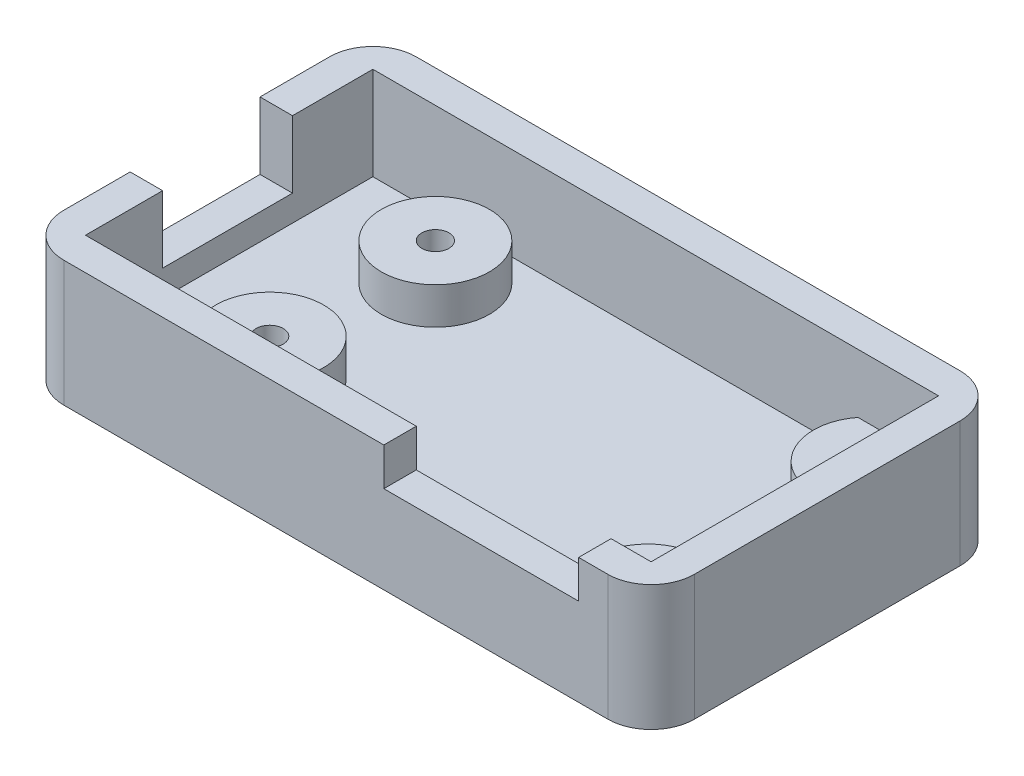
from build123d import *

# Parameters (mm, degrees)
BOSS_EXTRUDE1_DEPTH = 3
BOSS_EXTRUDE2_START = 3
SKETCH1_3_W         = 52.27
SKETCH1_3_H         = 26.56
BOSS_EXTRUDE2_DEPTH = 8.6
BOSS_EXTRUDE3_START = 3
SKETCH1_4_R         = 1.25
SKETCH1_4_R_2       = 5
BOSS_EXTRUDE3_DEPTH = 3.4
CUT_EXTRUDE1_REACH  = 65.526
SKETCH2_W           = 18
SKETCH2_H           = 3.5
CUT_EXTRUDE2_REACH  = 65.627
SKETCH4_W           = 12
SKETCH4_H           = 6.2
SKETCH1_5_R         = 1.25
CUT_EXTRUDE3_DEPTH  = 64.410066236


with BuildPart() as part:
    # Sketch1 → Boss-Extrude1 (new body)
    with BuildSketch(Plane(origin=(0, 0, 0), x_dir=(1, 0, 0), z_dir=(0, 1, 0))):
        with BuildLine():
            Line((-0.75, 3.25), (-51.02, 3.25))
            ThreePointArc((-51.02, 3.25), (-53.848427125, 2.078427125), (-55.02, -0.75))
            Line((-55.02, -0.75), (-55.02, -25.31))
            ThreePointArc((-55.02, -25.31), (-53.848427125, -28.138427125), (-51.02, -29.31))
            Line((-51.02, -29.31), (-0.75, -29.31))
            ThreePointArc((-0.75, -29.31), (2.078427125, -28.138427125), (3.25, -25.31))
            Line((3.25, -25.31), (3.25, -0.75))
            ThreePointArc((3.25, -0.75), (2.078427125, 2.078427125), (-0.75, 3.25))
        make_face()
    extrude(amount=BOSS_EXTRUDE1_DEPTH)

    # Sketch1<3> → Boss-Extrude2 (add)
    with BuildSketch(Plane(origin=(0, 0, 0), x_dir=(1, 0, 0), z_dir=(0, 1, 0)).offset(BOSS_EXTRUDE2_START)):
        with BuildLine():
            ThreePointArc((3.25, -0.75), (2.078427125, 2.078427125), (-0.75, 3.25))
            Line((-0.75, 3.25), (-51.02, 3.25))
            ThreePointArc((-51.02, 3.25), (-53.848427125, 2.078427125), (-55.02, -0.75))
            Line((-55.02, -0.75), (-55.02, -25.31))
            ThreePointArc((-55.02, -25.31), (-53.848427125, -28.138427125), (-51.02, -29.31))
            Line((-51.02, -29.31), (-0.75, -29.31))
            ThreePointArc((-0.75, -29.31), (2.078427125, -28.138427125), (3.25, -25.31))
            Line((3.25, -25.31), (3.25, -0.75))
        make_face()
        with Locations((-25.885, -13.03)):
            Rectangle(SKETCH1_3_W, SKETCH1_3_H, mode=Mode.SUBTRACT)
    extrude(amount=BOSS_EXTRUDE2_DEPTH)

    # Sketch1<4> → Boss-Extrude3 (add)
    # profile 1 of 4: a face of its own
    with BuildSketch(Plane(origin=(0, 0, 0), x_dir=(1, 0, 0), z_dir=(0, 1, 0)).offset(BOSS_EXTRUDE3_START)):
        with BuildLine():
            Line((0, 0), (-6.949288811, 0))
            ThreePointArc((-6.949288811, 0), (-6.559292713, -6.566539242), (0, -7.063745122))
            Line((0, -7.063745122), (0, 0))
        make_face()
        with Locations(Location((-2.995, -3.06, 0), (0, 0, 270))):
            Circle(SKETCH1_4_R, mode=Mode.SUBTRACT)
    # profile 2 of 4: a face of its own
    with BuildSketch(Plane(origin=(0, 0, 0), x_dir=(1, 0, 0), z_dir=(0, 1, 0)).offset(BOSS_EXTRUDE3_START)):
        with Locations(Location((-40.62, -5.375, 0), (0, 0, 270))):
            Circle(SKETCH1_4_R_2)
        with Locations(Location((-40.62, -5.375, 0), (0, 0, 270))):
            Circle(SKETCH1_4_R, mode=Mode.SUBTRACT)
    # profile 3 of 4: a face of its own
    with BuildSketch(Plane(origin=(0, 0, 0), x_dir=(1, 0, 0), z_dir=(0, 1, 0)).offset(BOSS_EXTRUDE3_START)):
        with Locations(Location((-40.62, -20.685, 0), (0, 0, 270))):
            Circle(SKETCH1_4_R_2)
        with Locations(Location((-40.62, -20.685, 0), (0, 0, 270))):
            Circle(SKETCH1_4_R, mode=Mode.SUBTRACT)
    # profile 4 of 4: a face of its own
    with BuildSketch(Plane(origin=(0, 0, 0), x_dir=(1, 0, 0), z_dir=(0, 1, 0)).offset(BOSS_EXTRUDE3_START)):
        with BuildLine():
            Line((0, -26.06), (0, -19.376254878))
            ThreePointArc((0, -19.376254878), (-6.392636874, -19.711749235), (-7.216089907, -26.06))
            Line((-7.216089907, -26.06), (0, -26.06))
        make_face()
        with Locations(Location((-2.995, -23.38, 0), (0, 0, 270))):
            Circle(SKETCH1_4_R, mode=Mode.SUBTRACT)
    extrude(amount=BOSS_EXTRUDE3_DEPTH)

    # Sketch2 → Cut-Extrude1 (cut, up to next)
    with BuildSketch(Plane(origin=(0, 0, 26.31), x_dir=(-1, 0, 0), z_dir=(0, 0, -1)), mode=Mode.PRIVATE) as cut_extrude1_sk1:
        with Locations((12.45, 9.85)):
            Rectangle(SKETCH2_W, SKETCH2_H)
    cut_extrude1_tool1 = extrude(cut_extrude1_sk1.sketch, amount=-CUT_EXTRUDE1_REACH, mode=Mode.PRIVATE) & part.part
    add(cut_extrude1_tool1.solids().sort_by_distance((-12.45, 9.85, 26.31))[0], mode=Mode.SUBTRACT)

    # Sketch4 → Cut-Extrude2 (cut, up to next)
    with BuildSketch(Plane(origin=(-52.02, 0, 0), x_dir=(0, 0, -1), z_dir=(1, 0, 0)), mode=Mode.PRIVATE) as cut_extrude2_sk1:
        with Locations((-13.17934126, 8.5)):
            Rectangle(SKETCH4_W, SKETCH4_H)
    cut_extrude2_tool1 = extrude(cut_extrude2_sk1.sketch, amount=-CUT_EXTRUDE2_REACH, mode=Mode.PRIVATE) & part.part
    add(cut_extrude2_tool1.solids().sort_by_distance((-52.02, 8.5, 13.179341))[0], mode=Mode.SUBTRACT)

    # Sketch1<5> → Cut-Extrude3 (cut, through all)
    with BuildSketch(Plane(origin=(0, 0, 0), x_dir=(1, 0, 0), z_dir=(0, 1, 0))):
        with Locations(Location((-2.995, -23.38, 0), (0, 0, 270))):
            Circle(SKETCH1_5_R)
        with Locations(Location((-2.995, -3.06, 0), (0, 0, 270))):
            Circle(SKETCH1_5_R)
        with Locations(Location((-40.62, -5.375, 0), (0, 0, 270))):
            Circle(SKETCH1_5_R)
        with Locations(Location((-40.62, -20.685, 0), (0, 0, 270))):
            Circle(SKETCH1_5_R)
    extrude(amount=CUT_EXTRUDE3_DEPTH, mode=Mode.SUBTRACT)


solid = part.part
